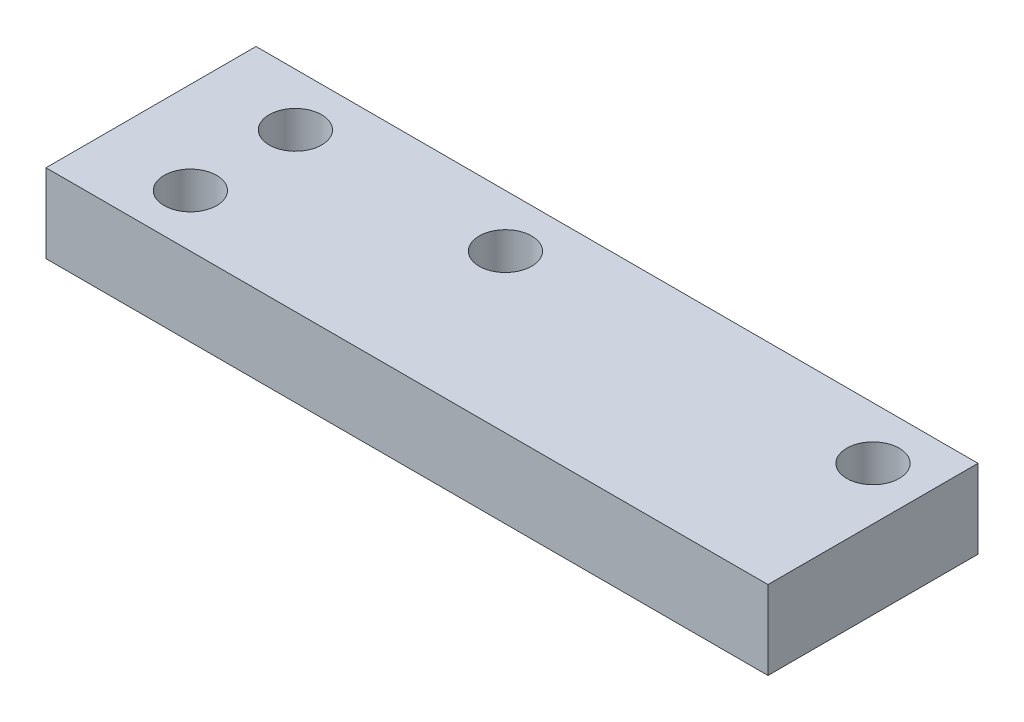
from build123d import *

# Parameters (mm, degrees)
SKETCH2_W           = 55
SKETCH2_H           = 16
SKETCH2_R           = 2
BOSS_EXTRUDE1_DEPTH = 6


with BuildPart() as part:
    # Sketch2 → Boss-Extrude1 (new body)
    with BuildSketch(Plane(origin=(0, 0, 0), x_dir=(1, 0, 0), z_dir=(0, 1, 0))):
        with Locations((27.5, -8)):
            Rectangle(SKETCH2_W, SKETCH2_H)
        with Locations(Location((23, -4, 0), (0, 0, 270))):
            Circle(SKETCH2_R, mode=Mode.SUBTRACT)
        with Locations(Location((51, -4, 0), (0, 0, 270))):
            Circle(SKETCH2_R, mode=Mode.SUBTRACT)
        with Locations(Location((7, -4, 0), (0, 0, 270))):
            Circle(SKETCH2_R, mode=Mode.SUBTRACT)
        with Locations(Location((7, -12, 0), (0, 0, 270))):
            Circle(SKETCH2_R, mode=Mode.SUBTRACT)
    extrude(amount=BOSS_EXTRUDE1_DEPTH)


solid = part.part
